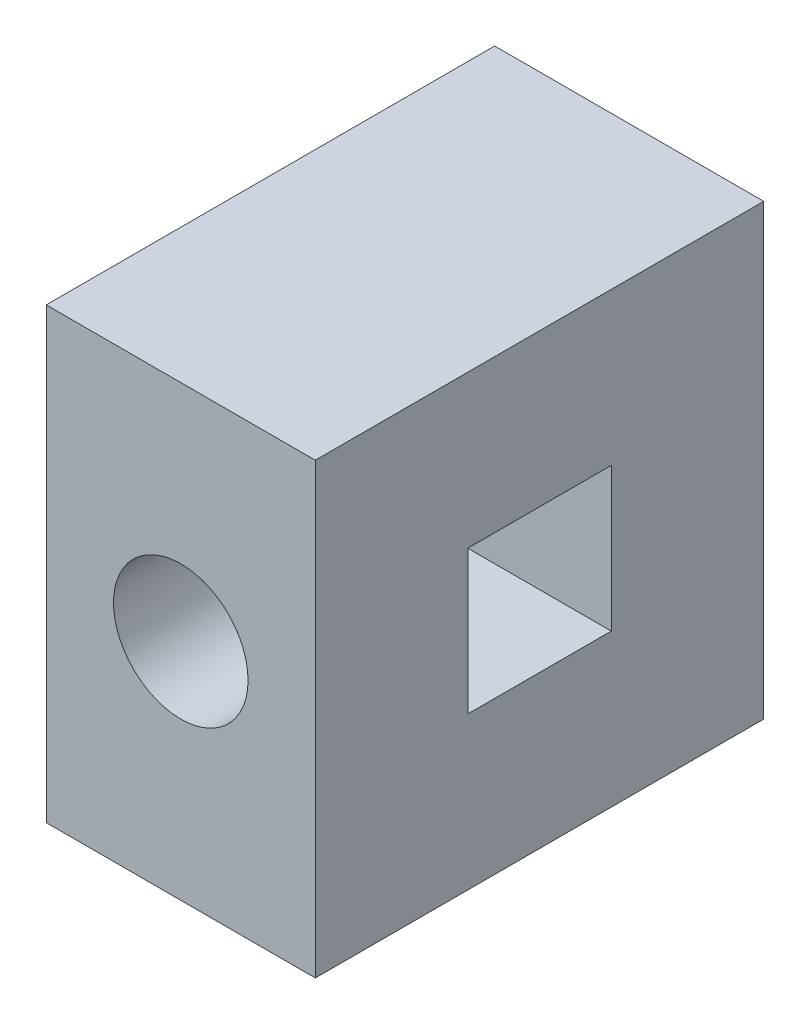
from build123d import *

# Parameters (mm, degrees)
SKETCH1_W           = 6
SKETCH1_H           = 10
SKETCH1_R           = 1.5
BOSS_EXTRUDE1_DEPTH = 10
SKETCH2_W           = 3.2
SKETCH2_H           = 3.2
CUT_EXTRUDE1_DEPTH  = 16.362291496
SKETCH1_3_R         = 1.5
BOSS_EXTRUDE2_DEPTH = 3.4


with BuildPart() as part:
    # Sketch1 → Boss-Extrude1 (new body)
    with BuildSketch(Plane.XY):
        with Locations((3, 5)):
            Rectangle(SKETCH1_W, SKETCH1_H)
        with Locations((3, 5)):
            Circle(SKETCH1_R, mode=Mode.SUBTRACT)
    extrude(amount=BOSS_EXTRUDE1_DEPTH)

    # Sketch2 → Cut-Extrude1 (cut, through all)
    with BuildSketch(Plane(origin=(6, 0, 0), x_dir=(0, 0, -1), z_dir=(1, 0, 0))):
        with Locations((-5, 5)):
            Rectangle(SKETCH2_W, SKETCH2_H)
    extrude(amount=-CUT_EXTRUDE1_DEPTH, mode=Mode.SUBTRACT)

    # Sketch1<3> → Boss-Extrude2 (add)
    with BuildSketch(Plane.XY):
        with Locations((3, 5)):
            Circle(SKETCH1_3_R)
        Polygon((0, 10), (6, 0), (0, 0), align=None)
        Polygon((0, 10), (6, 10), (6, 0), align=None)
    extrude(amount=BOSS_EXTRUDE2_DEPTH)


solid = part.part
